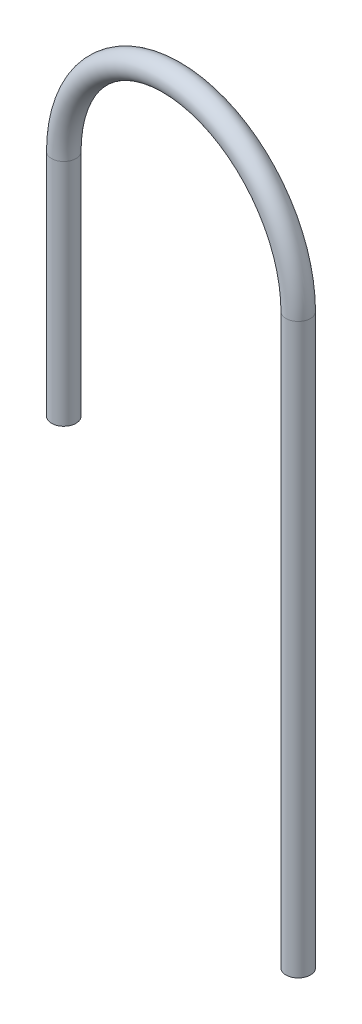
from build123d import *

# Parameters (mm, degrees)
BALAYAGE_MINCE1_PROFILE_R   = 3
BALAYAGE_MINCE1_PROFILE_R_2 = 2


with BuildPart() as part:
    # Balayage-Mince1: sweep along a curve in space
    with BuildLine() as balayage_mince1_path:
        Line((14, 165, -59.25), (14, 221.325, -59.25))
        ThreePointArc((14, 221.325, -59.25), (45.407462351, 252.840799577, -56.639074556), (76.814924701, 221.325, -54.028149113))
        Line((76.814924701, 221.325, -54.028149113), (76.814924701, 81.65, -54.028149113))
    # Balayage-Mince1 profile (on start of the path) → Balayage-Mince1 (sweep)
    with BuildSketch(Plane(origin=(14, 165, -59.25), x_dir=(0, 0, 1), z_dir=(0, 1, 0))):
        Circle(BALAYAGE_MINCE1_PROFILE_R)
        Circle(BALAYAGE_MINCE1_PROFILE_R_2, mode=Mode.SUBTRACT)
    sweep(path=balayage_mince1_path.line)


solid = part.part
